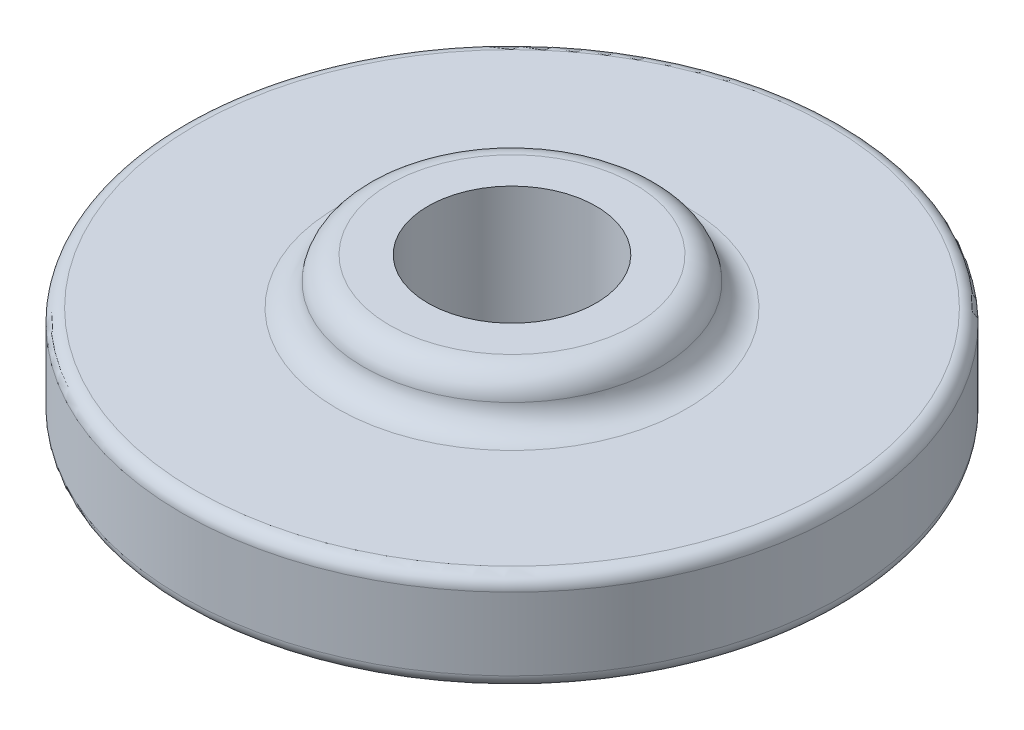
from build123d import *

# Parameters (mm, degrees)
SKETCH1_R           = 10
BOSS_EXTRUDE1_DEPTH = 3
SKETCH2_R           = 2.55
CUT_EXTRUDE1_DEPTH  = 2.6
FILLET1_R           = 0.4
BOSS_EXTRUDE2_START = 1.4
SKETCH3_R           = 4.5
SKETCH3_R_2         = 2.55
BOSS_EXTRUDE2_DEPTH = 1.4
FILLET2_R           = 0.8
FILLET3_R           = 0.8


with BuildPart() as part:
    # Sketch1 → Boss-Extrude1 (new body)
    with BuildSketch(Plane(origin=(0, 0, 0), x_dir=(1, 0, 0), z_dir=(0, 1, 0))):
        with Locations(Location((0, 0, 0), (0, 0, 270))):
            Circle(SKETCH1_R)
    extrude(amount=BOSS_EXTRUDE1_DEPTH)

    # Sketch2 → Cut-Extrude1 (cut)
    with BuildSketch(Plane(origin=(0, 3, 0), x_dir=(1, 0, 0), z_dir=(0, 1, 0))):
        with Locations(Location((0, 0, 0), (0, 0, 270))):
            Circle(SKETCH2_R)
    extrude(amount=-CUT_EXTRUDE1_DEPTH, mode=Mode.SUBTRACT)

    # Fillet1
    fillet1_edges = [part.edges().sort_by_distance(p)[0] for p in [
        (0, 0, -10),
        (0, 3, -10),
    ]]
    fillet(fillet1_edges, radius=FILLET1_R)

    # Sketch3 → Boss-Extrude2 (add)
    with BuildSketch(Plane(origin=(0, 3, 0), x_dir=(1, 0, 0), z_dir=(0, 1, 0)).offset(BOSS_EXTRUDE2_START)):
        with Locations(Location((0, 0, 0), (0, 0, 270))):
            Circle(SKETCH3_R)
        with Locations(Location((0, 0, 0), (0, 0, 270))):
            Circle(SKETCH3_R_2, mode=Mode.SUBTRACT)
    extrude(amount=-BOSS_EXTRUDE2_DEPTH)

    # Fillet2
    fillet2_edges = [part.edges().sort_by_distance(p)[0] for p in [
        (0, 3, -4.5),
    ]]
    fillet(fillet2_edges, radius=FILLET2_R)

    # Fillet3
    fillet3_edges = [part.edges().sort_by_distance(p)[0] for p in [
        (0, 4.4, -4.5),
    ]]
    fillet(fillet3_edges, radius=FILLET3_R)


solid = part.part
